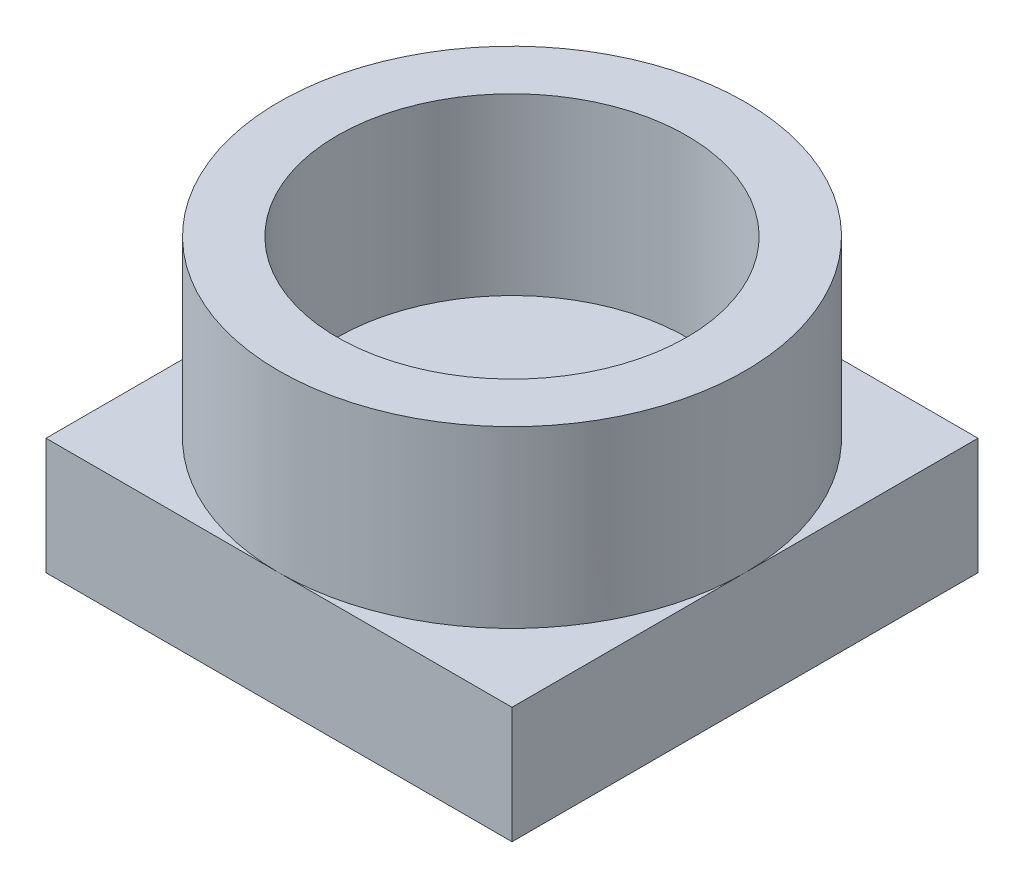
from build123d import *

# Parameters (mm, degrees)
IZIM1_W                     = 8
IZIM1_H                     = 8
Y_KSEKLIK_EKSTR_ZYON1_DEPTH = 2
IZIM2_R                     = 4
IZIM2_R_2                   = 3
EKSTR_ZYON_NCE1_DEPTH       = 3


with BuildPart() as part:
    # Çizim1 → Yükseklik-Ekstrüzyon1 (new body)
    with BuildSketch(Plane(origin=(0, 0, 0), x_dir=(1, 0, 0), z_dir=(0, 1, 0))):
        Rectangle(IZIM1_W, IZIM1_H)
    extrude(amount=Y_KSEKLIK_EKSTR_ZYON1_DEPTH)

    # Çizim2 → Ekstrüzyon-İnce1 (add)
    with BuildSketch(Plane(origin=(0, 2, 0), x_dir=(1, 0, 0), z_dir=(0, 1, 0))):
        Circle(IZIM2_R)
        Circle(IZIM2_R_2, mode=Mode.SUBTRACT)
    extrude(amount=EKSTR_ZYON_NCE1_DEPTH)


solid = part.part
